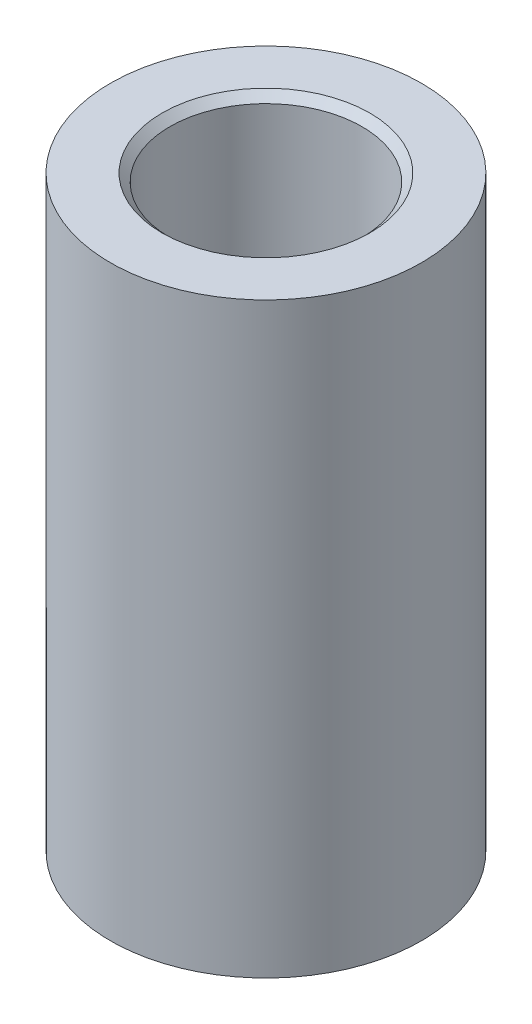
from build123d import *

# Parameters (mm, degrees)
SKETCH1_R                = 7.9375
BOSS_EXTRUDE1_DEPTH      = 29.972
W_0_386_DIAMETER_HOLE1_D = 9.8044
CHAMFER1_SIZE            = 0.4


with BuildPart() as part:
    # Sketch1 → Boss-Extrude1 (new body)
    with BuildSketch(Plane(origin=(0, 0, 0), x_dir=(1, 0, 0), z_dir=(0, 1, 0))):
        with Locations(Location((0, 0, 0), (0, 0, 90))):
            Circle(SKETCH1_R)
    extrude(amount=BOSS_EXTRUDE1_DEPTH)

    # W (0.386) Diameter Hole1 (through all)
    with Locations(Plane(origin=(0, 29.972, 0), x_dir=(1, 0, 0), z_dir=(0, 1, 0))):
        with Locations((0, 0)):
            Hole(W_0_386_DIAMETER_HOLE1_D / 2)

    # Chamfer1
    chamfer1_edges = [part.edges().sort_by_distance(p)[0] for p in [
        (4.9022, 29.972, 0),
        (4.9022, 0, 0),
    ]]
    chamfer(chamfer1_edges, length=CHAMFER1_SIZE)


solid = part.part
